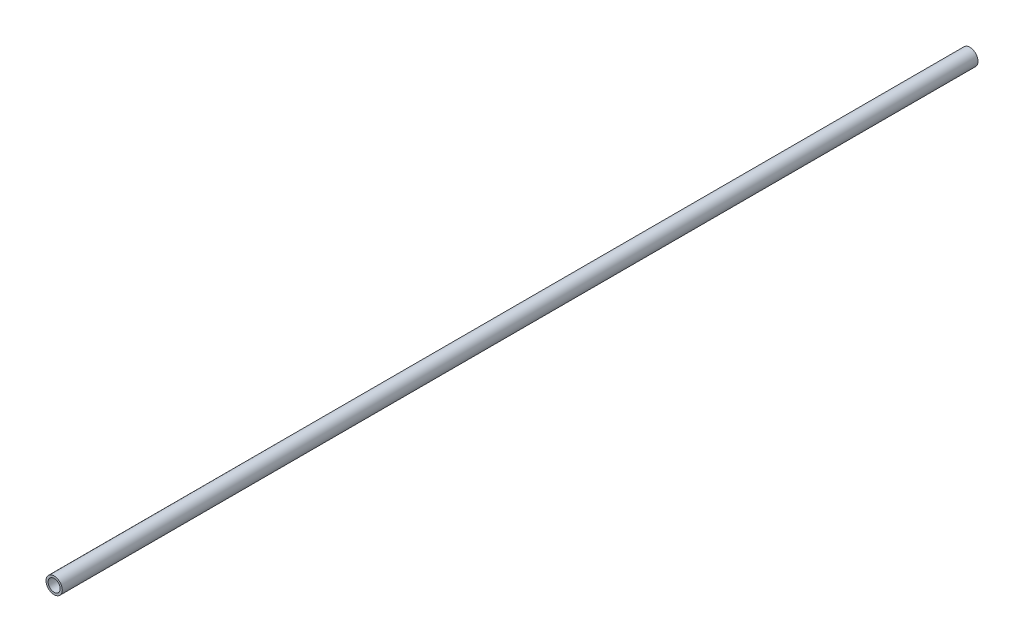
from build123d import *

# Parameters (mm, degrees)
SKETCH1_R           = 10.668
SKETCH1_R_2         = 7.8994
EXTRUDE_THIN1_DEPTH = 600


with BuildPart() as part:
    # Sketch1 → Extrude-Thin1 (new, symmetric)
    with BuildSketch(Plane.XY):
        Circle(SKETCH1_R)
        Circle(SKETCH1_R_2, mode=Mode.SUBTRACT)
    extrude(amount=EXTRUDE_THIN1_DEPTH, both=True)


solid = part.part
